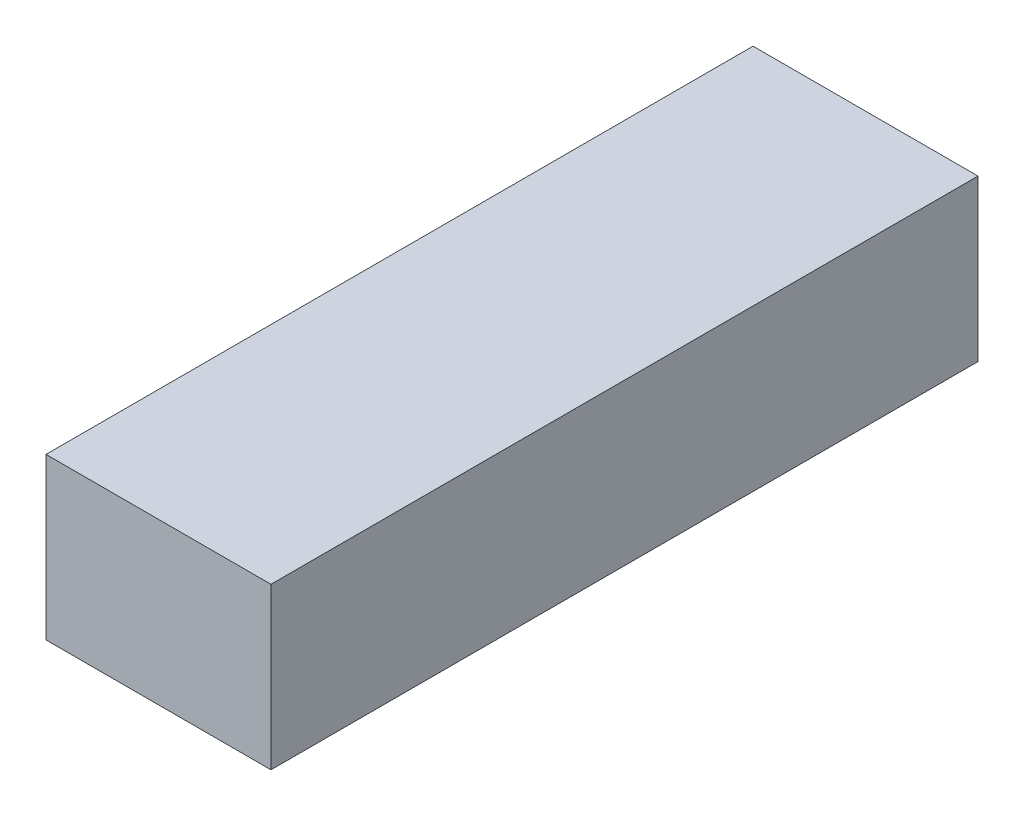
from build123d import *

# Parameters (mm, degrees)
SKETCH1_W           = 44.45
SKETCH1_H           = 139.7
BOSS_EXTRUDE1_DEPTH = 31.75


with BuildPart() as part:
    # Sketch1 → Boss-Extrude1 (new body)
    with BuildSketch(Plane(origin=(0, 0, 0), x_dir=(1, 0, 0), z_dir=(0, 1, 0))):
        Rectangle(SKETCH1_W, SKETCH1_H)
    extrude(amount=BOSS_EXTRUDE1_DEPTH)


solid = part.part
